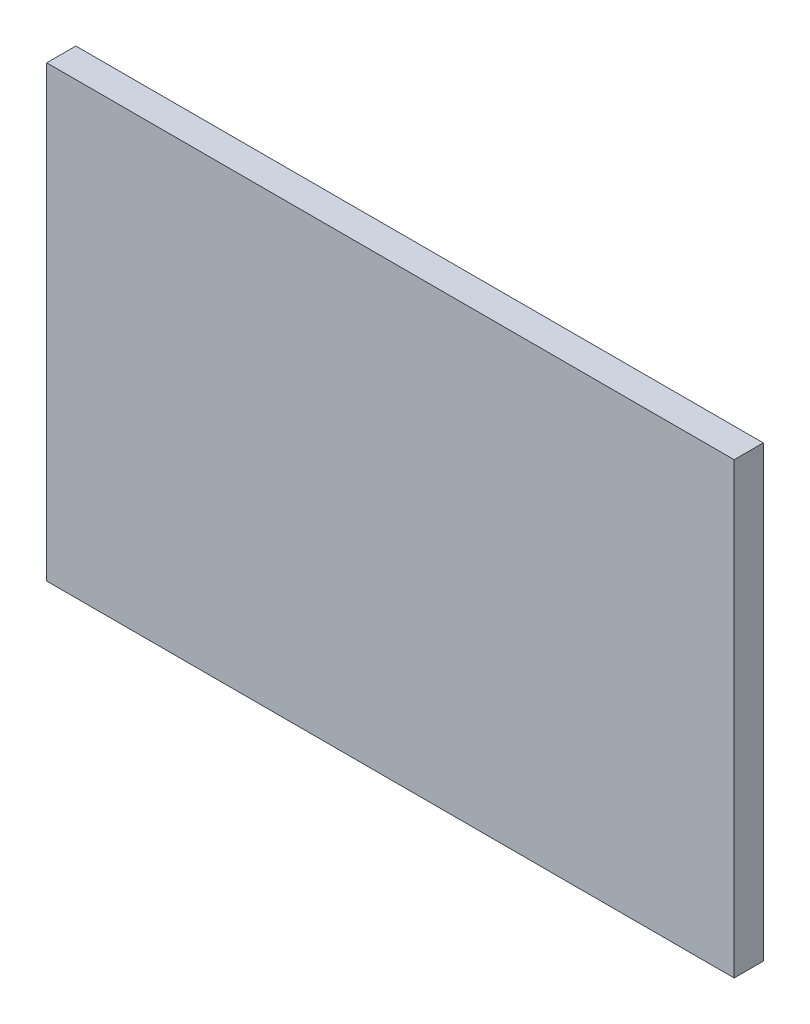
from build123d import *

# Parameters (mm, degrees)
SKETCH_1_W      = 85
SKETCH_1_H      = 55.5
EXTRUDE_1_DEPTH = 3.6


with BuildPart() as part:
    # 草图1 → 凸台-拉伸1 (new body)
    with BuildSketch(Plane(origin=(53.497504498, 2.808613122, 0), x_dir=(1, 0, 0), z_dir=(0, 0, 1))):
        with Locations((42.5, 27.75)):
            Rectangle(SKETCH_1_W, SKETCH_1_H)
    extrude(amount=EXTRUDE_1_DEPTH)


solid = part.part
